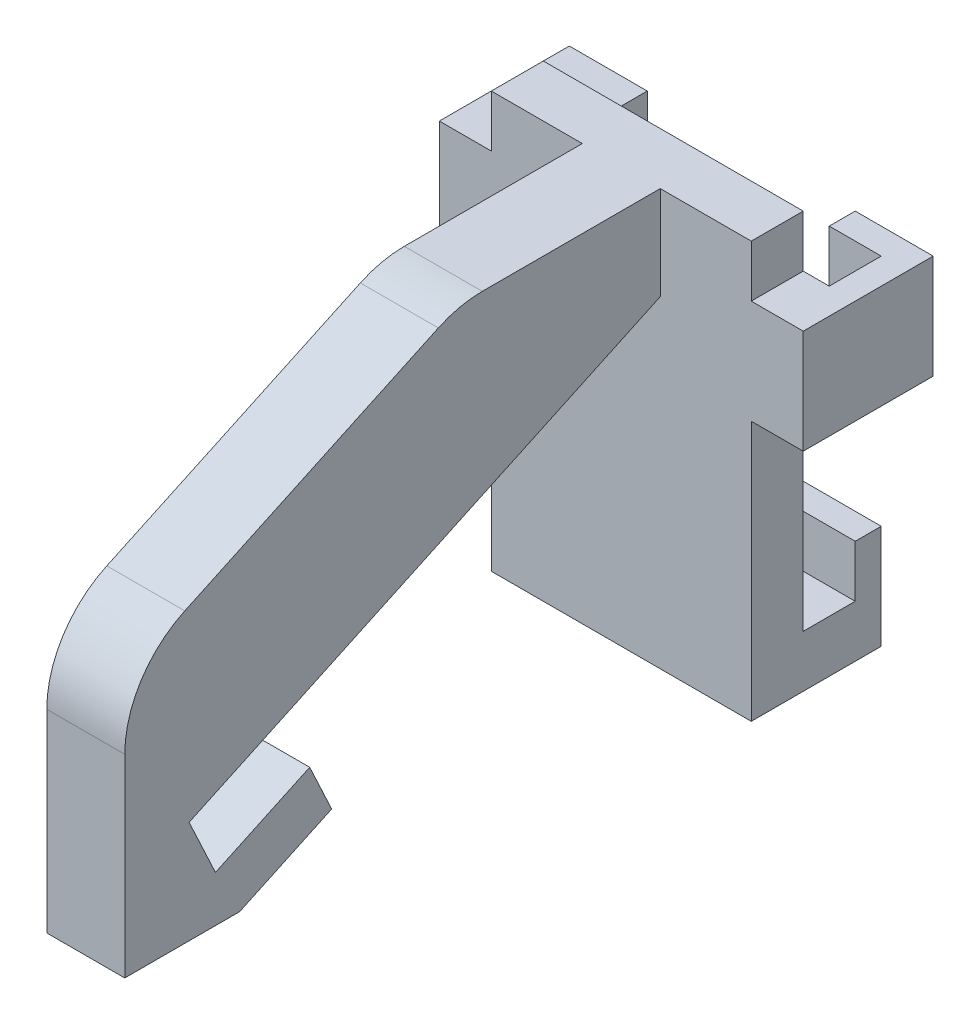
from build123d import *

# Parameters (mm, degrees)
BOSS_EXTRUDE2_DEPTH = 50
BOSS_EXTRUDE3_DEPTH = 20
BOSS_EXTRUDE4_DEPTH = 7.5
FILLET2_R           = 20
FILLET3_R           = 20


with BuildPart() as part:
    # Sketch2 → Boss-Extrude2 (new body)
    with BuildSketch(Plane(origin=(0, 0, 0), x_dir=(0, 0, -1), z_dir=(1, 0, 0))):
        Polygon((0, 0), (25, 0), (25, 20), (20, 20), (20, 10), (10, 10), (10, 80), (0, 80), align=None)
    extrude(amount=BOSS_EXTRUDE2_DEPTH)

    # Sketch3 → Boss-Extrude3 (add)
    with BuildSketch(Plane(origin=(0, 70, 0), x_dir=(1, 0, 0), z_dir=(0, 1, 0))):
        Polygon((50, 0), (60, 0), (60, 25), (45, 25), (45, 20), (50, 20), (55, 20), (55, 10), (50, 10), align=None)
    boss_extrude3 = extrude(amount=-BOSS_EXTRUDE3_DEPTH)

    # Mirror1: Boss-Extrude3 across plane
    add(boss_extrude3.mirror(Plane(origin=(25, 0, 0), x_dir=(0, 0, 1), z_dir=(1, 0, 0))))

    # Sketch5 → Boss-Extrude4 (add, symmetric)
    with BuildSketch(Plane(origin=(25, 0, 0), x_dir=(0, 0, -1), z_dir=(1, 0, 0))):
        Polygon((0, 80), (-38.670604871, 80), (-103.005812487, 50), (-103.005812487, 0), (-80.902994242, 0), (-63.207021205, 8.251767746), (-67.433203822, 17.314845616), (-85.559359563, 8.862480381), (-90.630778704, 19.738173826), (0, 62), align=None)
    extrude(amount=BOSS_EXTRUDE4_DEPTH, both=True)

    # Fillet2
    fillet2_edges = [part.edges().sort_by_distance(p)[0] for p in [
        (25, 80, 38.670604871),
    ]]
    fillet(fillet2_edges, radius=FILLET2_R)

    # Fillet3
    fillet3_edges = [part.edges().sort_by_distance(p)[0] for p in [
        (25, 50, 103.005812487),
    ]]
    fillet(fillet3_edges, radius=FILLET3_R)


solid = part.part
